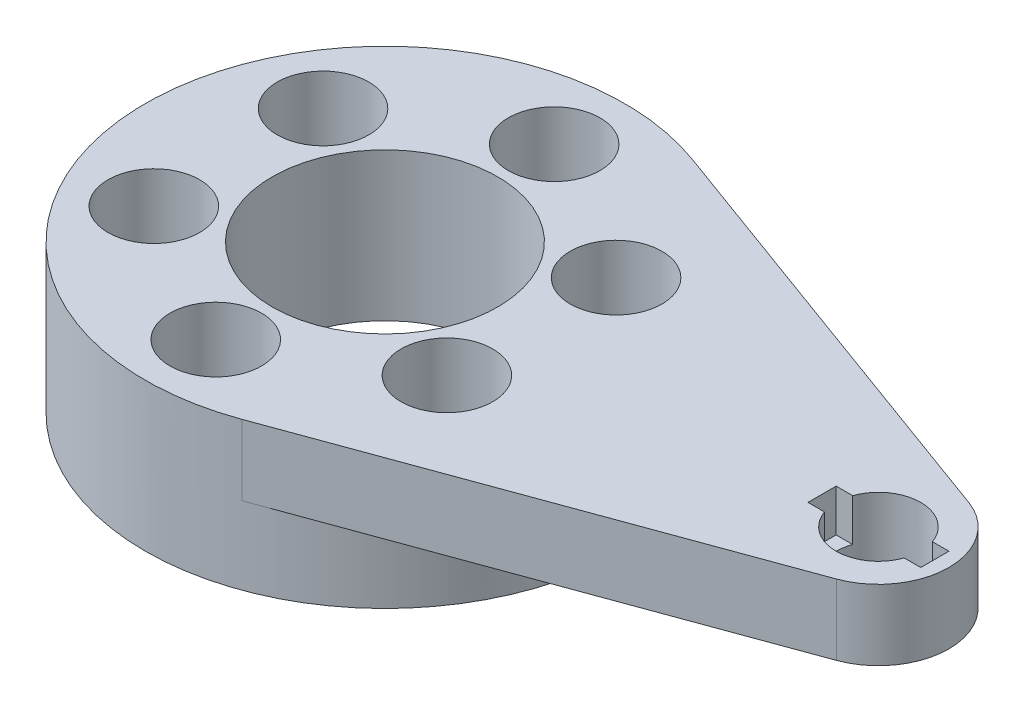
from build123d import *

# Parameters (mm, degrees)
SKETCH_1_R          = 17
SKETCH_1_R_2        = 2
SKETCH_1_R_3        = 8
EXTRUDE_1_DEPTH     = 5.5
EXTRUDE_START       = 5.5
SKETCH_1_3_R        = 2
SKETCH_1_3_R_2      = 3
SKETCH_1_3_R_3      = 8
EXTRUDE_2_DEPTH     = 5
SKETCH_2_R          = 3.25
CUT_EXTRUDE_4_DEPTH = 6
SKETCH_3_W          = 8
SKETCH_3_H          = 2
CUT_EXTRUDE_5_DEPTH = 3


with BuildPart() as part:
    # 스케치1 → 보스-돌출1 (new body)
    with BuildSketch(Plane(origin=(0, 0, 0), x_dir=(1, 0, 0), z_dir=(0, 1, 0))):
        with Locations(Location((0, 0, 0), (0, 0, 270))):
            Circle(SKETCH_1_R)
        with Locations(Location((0, 12, 0), (0, 0, 270))):
            Circle(SKETCH_1_R_2, mode=Mode.SUBTRACT)
        with Locations(Location((10.392304845, 6, 0), (0, 0, 270))):
            Circle(SKETCH_1_R_2, mode=Mode.SUBTRACT)
        with Locations(Location((10.392304845, -6, 0), (0, 0, 270))):
            Circle(SKETCH_1_R_2, mode=Mode.SUBTRACT)
        with Locations(Location((0, -12, 0), (0, 0, 270))):
            Circle(SKETCH_1_R_2, mode=Mode.SUBTRACT)
        with Locations(Location((-10.392304845, -6, 0), (0, 0, 270))):
            Circle(SKETCH_1_R_2, mode=Mode.SUBTRACT)
        with Locations(Location((-10.392304845, 6, 0), (0, 0, 270))):
            Circle(SKETCH_1_R_2, mode=Mode.SUBTRACT)
        with Locations(Location((0, 0, 0), (0, 0, 270))):
            Circle(SKETCH_1_R_3, mode=Mode.SUBTRACT)
    extrude(amount=EXTRUDE_1_DEPTH)

    # 스케치1<3> → 보스-돌출2 (add)
    with BuildSketch(Plane(origin=(0, 0, 0), x_dir=(1, 0, 0), z_dir=(0, 1, 0)).offset(EXTRUDE_START)):
        with BuildLine():
            Line((36.714285714, 4.696937778), (5.828571429, 15.969588445))
            ThreePointArc((5.828571429, 15.969588445), (-17, 0), (5.828571429, -15.969588445))
            Line((5.828571429, -15.969588445), (36.714285714, -4.696937778))
            ThreePointArc((36.714285714, -4.696937778), (40, 0), (36.714285714, 4.696937778))
        make_face()
        with Locations(Location((10.392304845, -6, 0), (0, 0, 270))):
            Circle(SKETCH_1_3_R, mode=Mode.SUBTRACT)
        with Locations(Location((0, -12, 0), (0, 0, 270))):
            Circle(SKETCH_1_3_R, mode=Mode.SUBTRACT)
        with Locations(Location((-10.392304845, -6, 0), (0, 0, 270))):
            Circle(SKETCH_1_3_R, mode=Mode.SUBTRACT)
        with Locations(Location((-10.392304845, 6, 0), (0, 0, 270))):
            Circle(SKETCH_1_3_R, mode=Mode.SUBTRACT)
        with Locations(Location((0, 12, 0), (0, 0, 270))):
            Circle(SKETCH_1_3_R, mode=Mode.SUBTRACT)
        with Locations(Location((10.392304845, 6, 0), (0, 0, 270))):
            Circle(SKETCH_1_3_R, mode=Mode.SUBTRACT)
        with Locations(Location((35, 0, 0), (0, 0, 270))):
            Circle(SKETCH_1_3_R_2, mode=Mode.SUBTRACT)
        with Locations(Location((0, 0, 0), (0, 0, 270))):
            Circle(SKETCH_1_3_R_3, mode=Mode.SUBTRACT)
    extrude(amount=EXTRUDE_2_DEPTH)

    # 스케치2 → 컷-돌출4 (cut)
    with BuildSketch(Plane(origin=(0, 10.5, 0), x_dir=(1, 0, 0), z_dir=(0, 1, 0))):
        with Locations(Location((0, 12, 0), (0, 0, 270))):
            Circle(SKETCH_2_R)
        with Locations(Location((10.392304845, 6, 0), (0, 0, 270))):
            Circle(SKETCH_2_R)
        with Locations(Location((10.392304845, -6, 0), (0, 0, 270))):
            Circle(SKETCH_2_R)
        with Locations(Location((0, -12, 0), (0, 0, 270))):
            Circle(SKETCH_2_R)
        with Locations(Location((-10.392304845, -6, 0), (0, 0, 270))):
            Circle(SKETCH_2_R)
        with Locations(Location((-10.392304845, 6, 0), (0, 0, 270))):
            Circle(SKETCH_2_R)
    extrude(amount=-CUT_EXTRUDE_4_DEPTH, mode=Mode.SUBTRACT)

    # 스케치3 → 컷-돌출5 (cut)
    with BuildSketch(Plane(origin=(0, 10.5, 0), x_dir=(1, 0, 0), z_dir=(0, 1, 0))):
        with Locations((35, 0)):
            Rectangle(SKETCH_3_W, SKETCH_3_H)
    extrude(amount=-CUT_EXTRUDE_5_DEPTH, mode=Mode.SUBTRACT)


solid = part.part
